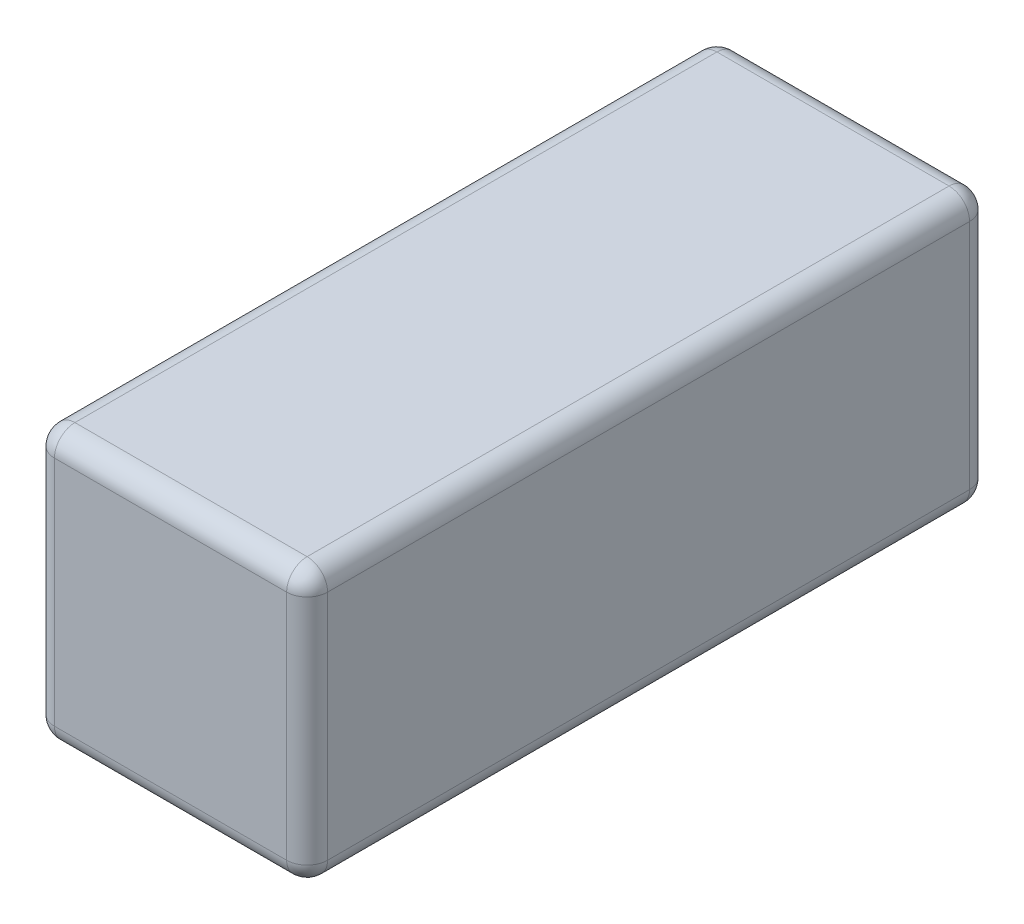
from build123d import *

# Parameters (mm, degrees)
BOSS_EXTRUDE1_DEPTH      = 5
BOSS_EXTRUDE1_DEPTH_BACK = 5
SKETCH3_W                = 2
SKETCH3_H                = 2
FILLET2_R                = 0.15
SKETCH4_W                = 2
SKETCH4_H                = 2
CUT_EXTRUDE1_DEPTH       = 5
FILLET3_R                = 0.15


with BuildPart() as part:
    # Sketch3 → Boss-Extrude1 (new, two sides: drawn at the far end of the back side and taken through both)
    with BuildSketch(Plane.XY.offset(-BOSS_EXTRUDE1_DEPTH_BACK)):
        Rectangle(SKETCH3_W, SKETCH3_H)
    extrude(amount=BOSS_EXTRUDE1_DEPTH + BOSS_EXTRUDE1_DEPTH_BACK)

    # Fillet2
    fillet2_edges = [part.edges().sort_by_distance(p)[0] for p in [
        (0, 1, 5),
        (0, -1, -5),
        (-1, 0, -5),
        (0, 1, -5),
        (1, 0, -5),
        (-1, 0, 5),
        (0, -1, 5),
        (1, 0, 5),
        (-1, -1, 0),
        (-1, 1, 0),
        (1, 1, 0),
        (1, -1, 0),
    ]]
    fillet(fillet2_edges, radius=FILLET2_R)

    # Sketch4 → Cut-Extrude1 (cut)
    with BuildSketch(Plane(origin=(0, 0, -5), x_dir=(-1, 0, 0), z_dir=(0, 0, -1))):
        Rectangle(SKETCH4_W, SKETCH4_H)
    extrude(amount=-CUT_EXTRUDE1_DEPTH, mode=Mode.SUBTRACT)

    # Fillet3
    fillet3_edges = [part.edges().sort_by_distance(p)[0] for p in [
        (1, 0, 0),
        (0, -1, 0),
        (0.956066017, 0.956066017, 0),
        (0.956066017, -0.956066017, 0),
        (-0.956066017, 0.956066017, 0),
        (-1, 0, 0),
        (0, 1, 0),
        (-0.956066017, -0.956066017, 0),
    ]]
    fillet(fillet3_edges, radius=FILLET3_R)


solid = part.part
